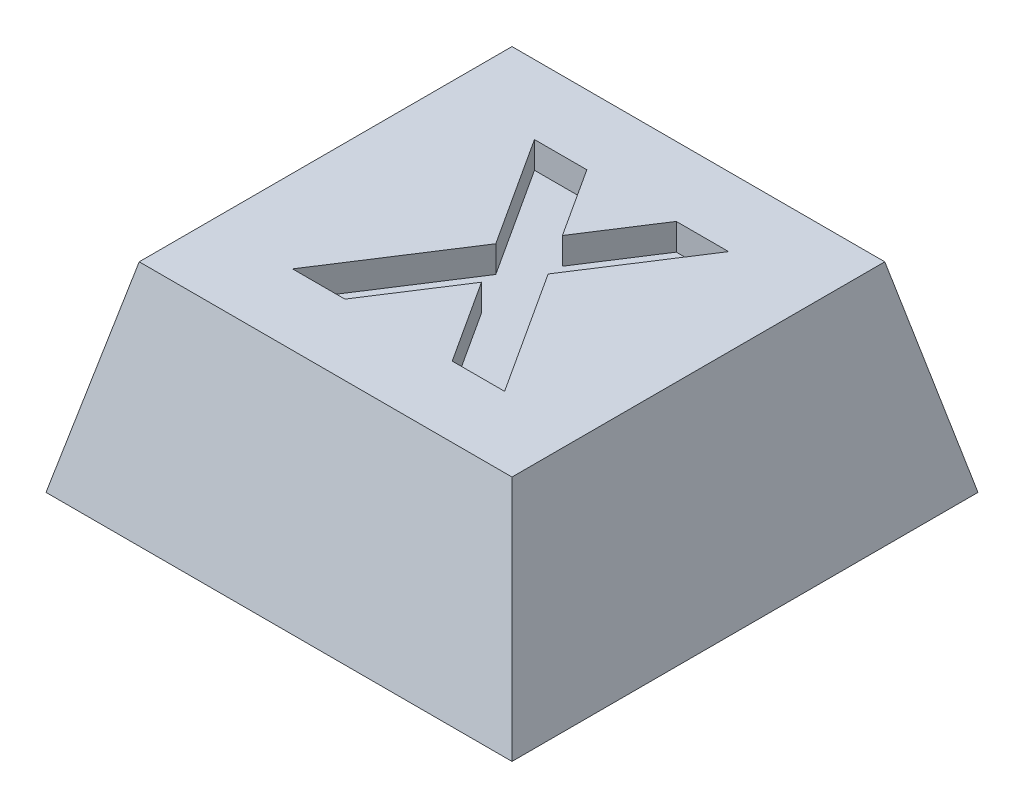
from build123d import *

# Parameters (mm, degrees)
SKETCH1_W           = 7
SKETCH1_H           = 7
BOSS_EXTRUDE1_DEPTH = 3
CUT_EXTRUDE1_DEPTH  = 7
CUT_EXTRUDE2_DEPTH  = 11
SKETCH4_R           = 1.8
CUT_EXTRUDE3_DEPTH  = 0.8
CUT_EXTRUDE4_DEPTH  = 0.4


with BuildPart() as part:
    # Sketch1 → Boss-Extrude1 (new body)
    with BuildSketch(Plane(origin=(0, 0, 0), x_dir=(1, 0, 0), z_dir=(0, 1, 0))):
        with Locations((3.5, 3.5)):
            Rectangle(SKETCH1_W, SKETCH1_H)
    extrude(amount=BOSS_EXTRUDE1_DEPTH)

    # Sketch2 → Cut-Extrude1 (cut)
    with BuildSketch(Plane.XY):
        Polygon((0, 0), (0.7, 3), (0, 3), align=None)
        Polygon((7, 0), (6.3, 3), (7, 3), align=None)
    extrude(amount=-CUT_EXTRUDE1_DEPTH, mode=Mode.SUBTRACT)

    # Sketch3 → Cut-Extrude2 (cut)
    with BuildSketch(Plane(origin=(0, 0, 0), x_dir=(0, 0, -1), z_dir=(1, 0, 0))):
        Polygon((0, 0), (0.7, 3), (0, 3), align=None)
        Polygon((7, 3), (6.3, 3), (7, 0), align=None)
    extrude(amount=CUT_EXTRUDE2_DEPTH, mode=Mode.SUBTRACT)

    # Sketch4 → Cut-Extrude3 (cut)
    with BuildSketch(Plane.XZ):
        with Locations(Location((3.5, -3.5, 0), (0, 0, 270))):
            Circle(SKETCH4_R)
    extrude(amount=-CUT_EXTRUDE3_DEPTH, mode=Mode.SUBTRACT)

    # Sketch5 → Cut-Extrude4 (cut)
    with BuildSketch(Plane(origin=(0, 3, 0), x_dir=(1, 0, 0), z_dir=(0, 1, 0))):
        Polygon((1.943645472, 1.759282352), (3.143264863, 3.613048377), (2.078260857, 5.259282352), (2.864919511, 5.259282352), (3.53659419, 4.220920973), (4.20826887, 5.259282352), (4.994927523, 5.259282352), (3.929923517, 3.613048377), (5.129542908, 1.759282352), (4.342884254, 1.759282352), (3.53659419, 3.005175781), (2.730304126, 1.759282352), align=None)
    extrude(amount=-CUT_EXTRUDE4_DEPTH, mode=Mode.SUBTRACT)


solid = part.part
